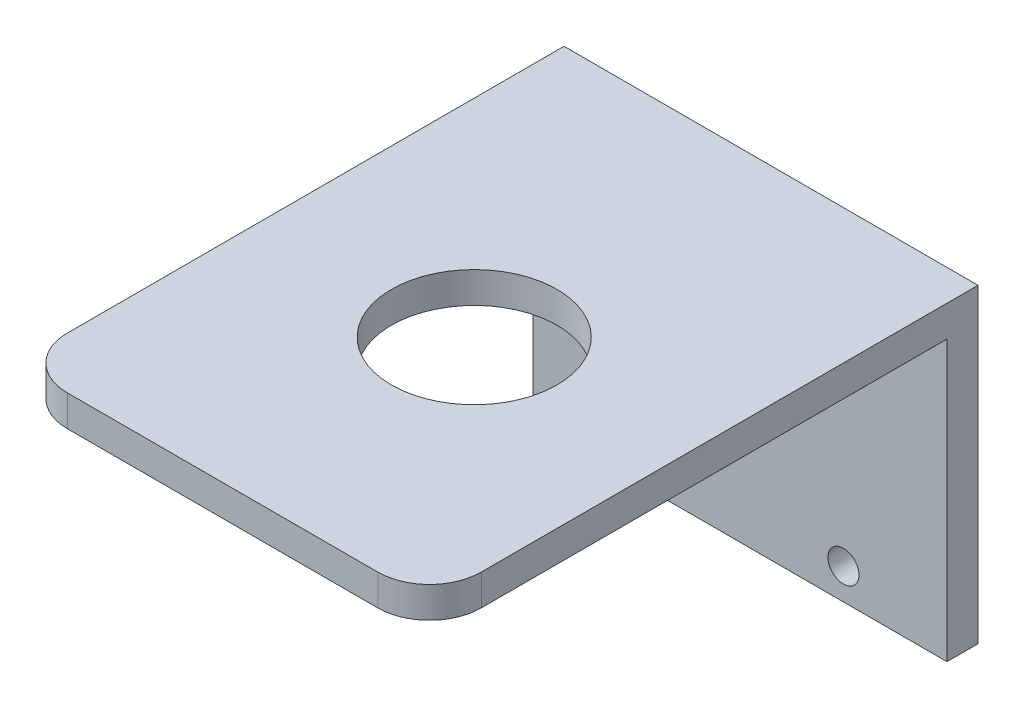
from build123d import *

# Parameters (mm, degrees)
SKETCH1_W           = 40
SKETCH1_H           = 30
SKETCH1_R           = 1.5
BOSS_EXTRUDE1_DEPTH = 3
SKETCH2_W           = 40
SKETCH2_H           = 3
BOSS_EXTRUDE2_DEPTH = 50
FILLET1_R           = 5
SKETCH3_R           = 8
CUT_EXTRUDE1_DEPTH  = 3


with BuildPart() as part:
    # Sketch1 → Boss-Extrude1 (new body)
    with BuildSketch(Plane.XY):
        Rectangle(SKETCH1_W, SKETCH1_H)
        with Locations((-10, 8)):
            Circle(SKETCH1_R, mode=Mode.SUBTRACT)
        with Locations((10, 8)):
            Circle(SKETCH1_R, mode=Mode.SUBTRACT)
        with Locations((-10, -12)):
            Circle(SKETCH1_R, mode=Mode.SUBTRACT)
        with Locations((10, -12)):
            Circle(SKETCH1_R, mode=Mode.SUBTRACT)
    extrude(amount=BOSS_EXTRUDE1_DEPTH)

    # Sketch2 → Boss-Extrude2 (add)
    with BuildSketch(Plane.XY.offset(3)):
        with Locations((0, 13.5)):
            Rectangle(SKETCH2_W, SKETCH2_H)
    extrude(amount=BOSS_EXTRUDE2_DEPTH)

    # Fillet1
    fillet1_edges = [part.edges().sort_by_distance(p)[0] for p in [
        (-20, 13.5, 53),
        (20, 13.5, 53),
    ]]
    fillet(fillet1_edges, radius=FILLET1_R)

    # Sketch3 → Cut-Extrude1 (cut)
    with BuildSketch(Plane(origin=(0, 15, 0), x_dir=(1, 0, 0), z_dir=(0, 1, 0))):
        with Locations(Location((0, -28.681080483, 0), (0, 0, 270))):
            Circle(SKETCH3_R)
    extrude(amount=-CUT_EXTRUDE1_DEPTH, mode=Mode.SUBTRACT)


solid = part.part
